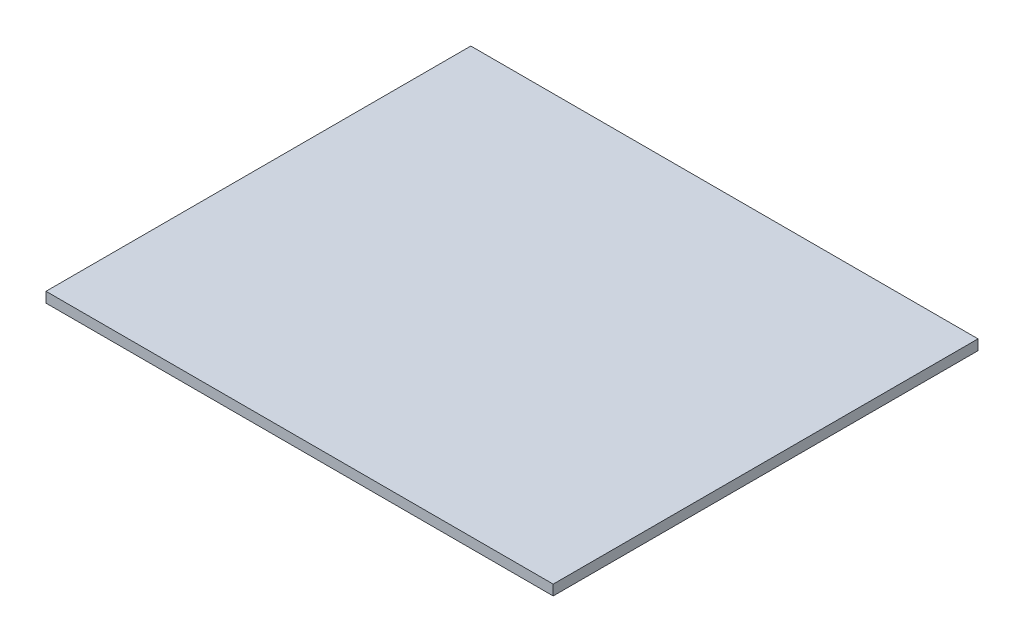
from build123d import *

# Parameters (mm, degrees)
SKETCH1_W           = 625.475
SKETCH1_H           = 523.875
BOSS_EXTRUDE1_DEPTH = 12.7


with BuildPart() as part:
    # Sketch1 → Boss-Extrude1 (new body)
    with BuildSketch(Plane(origin=(0, 0, 0), x_dir=(1, 0, 0), z_dir=(0, 1, 0))):
        with Locations((312.7375, -261.9375)):
            Rectangle(SKETCH1_W, SKETCH1_H)
    extrude(amount=BOSS_EXTRUDE1_DEPTH)


solid = part.part
